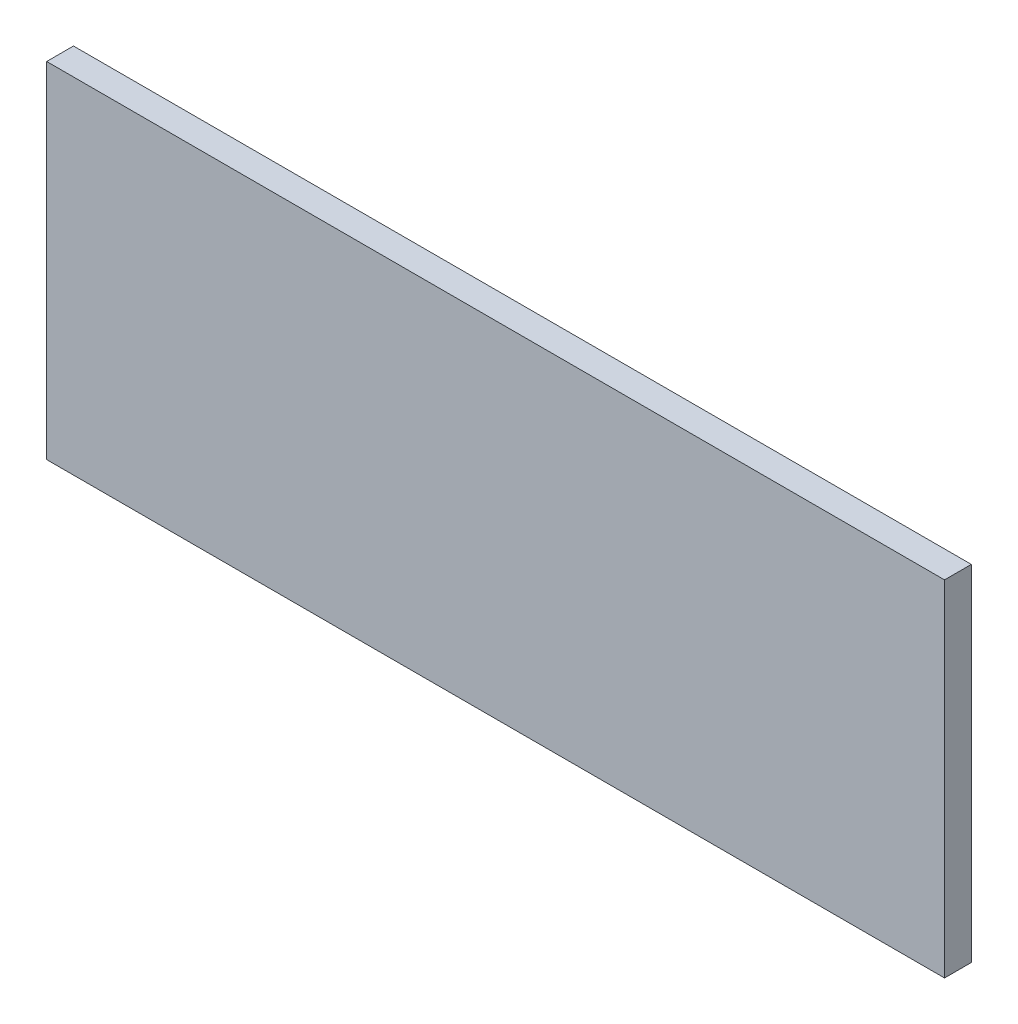
from build123d import *

# Parameters (mm, degrees)
SKETCH1_W           = 638.1
SKETCH1_H           = 245.05
BOSS_EXTRUDE1_DEPTH = 19.05


with BuildPart() as part:
    # Sketch1 → Boss-Extrude1 (new body)
    with BuildSketch(Plane.XY):
        with Locations((0, -103.475)):
            Rectangle(SKETCH1_W, SKETCH1_H)
    extrude(amount=BOSS_EXTRUDE1_DEPTH)


solid = part.part
